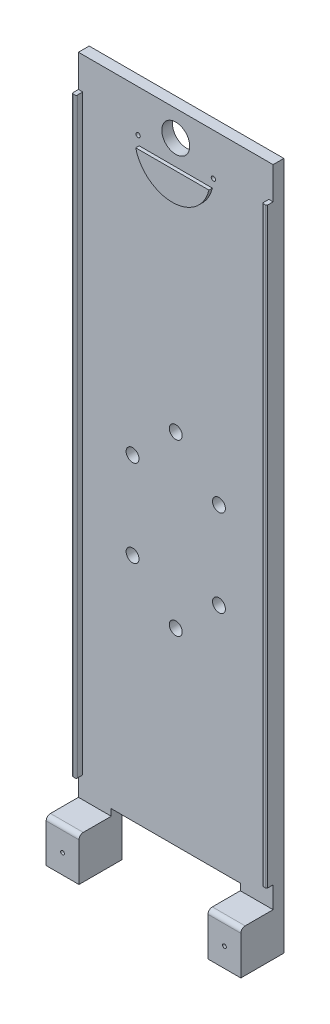
from build123d import *

# Parameters (mm, degrees)
SKETCH1_W                    = 320
SKETCH1_H                    = 90.51
CHASSIS_BASE_DEPTH           = 5
SKETCH3_W                    = 2
SKETCH3_H                    = 275
LATERAL_GUARD_DEPTH          = 3
DRIVE_ATTACHMENT_POINT_REACH = 168.469
SKETCH4_R                    = 3
CUT_EXTRUDE2_REACH           = 168.352
SKETCH5_R                    = 6.5
SKETCH5_R_2                  = 1
SKETCH6_W                    = 20
SKETCH6_H                    = 20
BOSS_EXTRUDE1_DEPTH          = 90.51
CUT_EXTRUDE3_REACH           = 169.475
SKETCH7_W                    = 60
SKETCH7_H                    = 23.073600821
FILLET3_R                    = 0.5
FILLET4_R                    = 2
SKETCH9_R                    = 0.875
CUT_EXTRUDE5_DEPTH           = 5
SKETCH10_R                   = 0.875
CUT_EXTRUDE6_DEPTH           = 5
SKETCH11_R                   = 0.875
CUT_EXTRUDE7_DEPTH           = 5
SKETCH12_R                   = 0.875
CUT_EXTRUDE8_DEPTH           = 5
SKETCH13_R                   = 0.875
CUT_EXTRUDE9_DEPTH           = 5
SKETCH14_R                   = 0.875
CUT_EXTRUDE10_DEPTH          = 5
BOSS_EXTRUDE2_DEPTH          = 1.6


with BuildPart() as part:
    # Sketch1 → Chassis Base (new body)
    with BuildSketch(Plane(origin=(0, 0, 0), x_dir=(0, 1, 0), z_dir=(0, 0, 1))):
        Rectangle(SKETCH1_W, SKETCH1_H)
    extrude(amount=CHASSIS_BASE_DEPTH)

    # Sketch3 → Lateral Guard (add)
    with BuildSketch(Plane.XY.offset(5)):
        with Locations((-44.255, 7.5)):
            Rectangle(SKETCH3_W, SKETCH3_H)
        with Locations((44.255, 7.5)):
            Rectangle(SKETCH3_W, SKETCH3_H)
    extrude(amount=LATERAL_GUARD_DEPTH)

    # Sketch4 → Drive Attachment Point (cut, up to next)
    with BuildSketch(Plane(origin=(0, 0, 0), x_dir=(1, 0, 0), z_dir=(0, 0, -1)), mode=Mode.PRIVATE) as drive_attachment_point_sk1:
        with Locations(Location((0, -29.7, 0), (0, 0, 180))):
            Circle(SKETCH4_R)
    drive_attachment_point_tool1 = extrude(drive_attachment_point_sk1.sketch, amount=-DRIVE_ATTACHMENT_POINT_REACH, mode=Mode.PRIVATE) & part.part
    # Sketch4 → Drive Attachment Point (cut, up to next)
    with BuildSketch(Plane(origin=(0, 0, 0), x_dir=(1, 0, 0), z_dir=(0, 0, -1)), mode=Mode.PRIVATE) as drive_attachment_point_sk2:
        with Locations(Location((-20.08, 30, 0), (0, 0, 180))):
            Circle(SKETCH4_R)
    drive_attachment_point_tool2 = extrude(drive_attachment_point_sk2.sketch, amount=-DRIVE_ATTACHMENT_POINT_REACH, mode=Mode.PRIVATE) & part.part
    # Sketch4 → Drive Attachment Point (cut, up to next)
    with BuildSketch(Plane(origin=(0, 0, 0), x_dir=(1, 0, 0), z_dir=(0, 0, -1)), mode=Mode.PRIVATE) as drive_attachment_point_sk3:
        with Locations((20.08, 30)):
            Circle(SKETCH4_R)
    drive_attachment_point_tool3 = extrude(drive_attachment_point_sk3.sketch, amount=-DRIVE_ATTACHMENT_POINT_REACH, mode=Mode.PRIVATE) & part.part
    # Sketch4 → Drive Attachment Point (cut, up to next)
    with BuildSketch(Plane(origin=(0, 0, 0), x_dir=(1, 0, 0), z_dir=(0, 0, -1)), mode=Mode.PRIVATE) as drive_attachment_point_sk4:
        with Locations(Location((0, 49.3, 0), (0, 0, 180))):
            Circle(SKETCH4_R)
    drive_attachment_point_tool4 = extrude(drive_attachment_point_sk4.sketch, amount=-DRIVE_ATTACHMENT_POINT_REACH, mode=Mode.PRIVATE) & part.part
    # Sketch4 → Drive Attachment Point (cut, up to next)
    with BuildSketch(Plane(origin=(0, 0, 0), x_dir=(1, 0, 0), z_dir=(0, 0, -1)), mode=Mode.PRIVATE) as drive_attachment_point_sk5:
        with Locations(Location((-20.08, -10.4, 0), (0, 0, 180))):
            Circle(SKETCH4_R)
    drive_attachment_point_tool5 = extrude(drive_attachment_point_sk5.sketch, amount=-DRIVE_ATTACHMENT_POINT_REACH, mode=Mode.PRIVATE) & part.part
    # Sketch4 → Drive Attachment Point (cut, up to next)
    with BuildSketch(Plane(origin=(0, 0, 0), x_dir=(1, 0, 0), z_dir=(0, 0, -1)), mode=Mode.PRIVATE) as drive_attachment_point_sk6:
        with Locations(Location((20.08, -10.4, 0), (0, 0, 180))):
            Circle(SKETCH4_R)
    drive_attachment_point_tool6 = extrude(drive_attachment_point_sk6.sketch, amount=-DRIVE_ATTACHMENT_POINT_REACH, mode=Mode.PRIVATE) & part.part
    add(drive_attachment_point_tool1.solids().sort_by_distance((0, 29.7, 0))[0], mode=Mode.SUBTRACT)
    add(drive_attachment_point_tool2.solids().sort_by_distance((-20.08, -30, 0))[0], mode=Mode.SUBTRACT)
    add(drive_attachment_point_tool3.solids().sort_by_distance((20.08, -30, 0))[0], mode=Mode.SUBTRACT)
    add(drive_attachment_point_tool4.solids().sort_by_distance((0, -49.3, 0))[0], mode=Mode.SUBTRACT)
    add(drive_attachment_point_tool5.solids().sort_by_distance((-20.08, 10.4, 0))[0], mode=Mode.SUBTRACT)
    add(drive_attachment_point_tool6.solids().sort_by_distance((20.08, 10.4, 0))[0], mode=Mode.SUBTRACT)

    # Sketch5 → Cut-Extrude2 (cut, up to next)
    with BuildSketch(Plane.XY.offset(5), mode=Mode.PRIVATE) as cut_extrude2_sk1:
        with Locations((0, 148)):
            Circle(SKETCH5_R)
    cut_extrude2_tool1 = extrude(cut_extrude2_sk1.sketch, amount=-CUT_EXTRUDE2_REACH, mode=Mode.PRIVATE) & part.part
    # Sketch5 → Cut-Extrude2 (cut, up to next)
    with BuildSketch(Plane.XY.offset(5), mode=Mode.PRIVATE) as cut_extrude2_sk2:
        with Locations((-17.5, 140.5)):
            Circle(SKETCH5_R_2)
    cut_extrude2_tool2 = extrude(cut_extrude2_sk2.sketch, amount=-CUT_EXTRUDE2_REACH, mode=Mode.PRIVATE) & part.part
    # Sketch5 → Cut-Extrude2 (cut, up to next)
    with BuildSketch(Plane.XY.offset(5), mode=Mode.PRIVATE) as cut_extrude2_sk3:
        with Locations((17.5, 140.5)):
            Circle(SKETCH5_R_2)
    cut_extrude2_tool3 = extrude(cut_extrude2_sk3.sketch, amount=-CUT_EXTRUDE2_REACH, mode=Mode.PRIVATE) & part.part
    add(cut_extrude2_tool1.solids().sort_by_distance((0, 148, 5))[0], mode=Mode.SUBTRACT)
    add(cut_extrude2_tool2.solids().sort_by_distance((-17.5, 140.5, 5))[0], mode=Mode.SUBTRACT)
    add(cut_extrude2_tool3.solids().sort_by_distance((17.5, 140.5, 5))[0], mode=Mode.SUBTRACT)

    # Sketch6 → Boss-Extrude1 (add)
    with BuildSketch(Plane.YZ.offset(45.255)):
        with Locations((-150, 10)):
            Rectangle(SKETCH6_W, SKETCH6_H)
    extrude(amount=-BOSS_EXTRUDE1_DEPTH)

    # Sketch7 → Cut-Extrude3 (cut, up to next)
    with BuildSketch(Plane.XY.offset(20), mode=Mode.PRIVATE) as cut_extrude3_sk1:
        with Locations((0, -148.463199589)):
            Rectangle(SKETCH7_W, SKETCH7_H)
    cut_extrude3_tool1 = extrude(cut_extrude3_sk1.sketch, amount=-CUT_EXTRUDE3_REACH, mode=Mode.PRIVATE) & part.part
    add(cut_extrude3_tool1.solids().sort_by_distance((0, -148.4632, 20))[0], mode=Mode.SUBTRACT)

    # Fillet3
    fillet3_edges = [part.edges().sort_by_distance(p)[0] for p in [
        (-45.255, 7.5, 8),
        (-43.255, 7.5, 8),
        (45.255, 7.5, 8),
        (43.255, 7.5, 8),
    ]]
    fillet(fillet3_edges, radius=FILLET3_R)

    # Fillet4
    fillet4_edges = [part.edges().sort_by_distance(p)[0] for p in [
        (37.6275, -140, 20),
        (-37.6275, -140, 20),
    ]]
    fillet(fillet4_edges, radius=FILLET4_R)

    # Sketch9 → Cut-Extrude5 (cut)
    with BuildSketch(Plane.XY.offset(20)):
        with Locations((-37.6275, -151)):
            Circle(SKETCH9_R)
    extrude(amount=-CUT_EXTRUDE5_DEPTH, mode=Mode.SUBTRACT)

    # Sketch10 → Cut-Extrude6 (cut)
    with BuildSketch(Plane.XZ.offset(160)):
        with Locations(Location((-37.6275, 10, 0), (0, 0, 270))):
            Circle(SKETCH10_R)
    extrude(amount=-CUT_EXTRUDE6_DEPTH, mode=Mode.SUBTRACT)

    # Sketch11 → Cut-Extrude7 (cut)
    with BuildSketch(Plane(origin=(0, 0, 0), x_dir=(1, 0, 0), z_dir=(0, 0, -1))):
        with Locations(Location((-37.6275, 148.599605515, 0), (0, 0, 180))):
            Circle(SKETCH11_R)
    extrude(amount=-CUT_EXTRUDE7_DEPTH, mode=Mode.SUBTRACT)

    # Sketch12 → Cut-Extrude8 (cut)
    with BuildSketch(Plane(origin=(0, 0, 0), x_dir=(1, 0, 0), z_dir=(0, 0, -1))):
        with Locations(Location((37.6275, 148.463199589, 0), (0, 0, 180))):
            Circle(SKETCH12_R)
    extrude(amount=-CUT_EXTRUDE8_DEPTH, mode=Mode.SUBTRACT)

    # Sketch13 → Cut-Extrude9 (cut)
    with BuildSketch(Plane.XZ.offset(160)):
        with Locations(Location((37.6275, 10, 0), (0, 0, 270))):
            Circle(SKETCH13_R)
    extrude(amount=-CUT_EXTRUDE9_DEPTH, mode=Mode.SUBTRACT)

    # Sketch14 → Cut-Extrude10 (cut)
    with BuildSketch(Plane.XY.offset(20)):
        with Locations((37.6275, -151)):
            Circle(SKETCH14_R)
    extrude(amount=-CUT_EXTRUDE10_DEPTH, mode=Mode.SUBTRACT)

    # Sketch15 → Boss-Extrude2 (add)
    with BuildSketch(Plane.XY.offset(5)):
        with BuildLine():
            Line((-17.021586315, 136.436061109), (17.021586315, 136.436061109))
            ThreePointArc((17.021586315, 136.436061109), (0, 123), (-17.021586315, 136.436061109))
        make_face()
    extrude(amount=BOSS_EXTRUDE2_DEPTH)


solid = part.part
